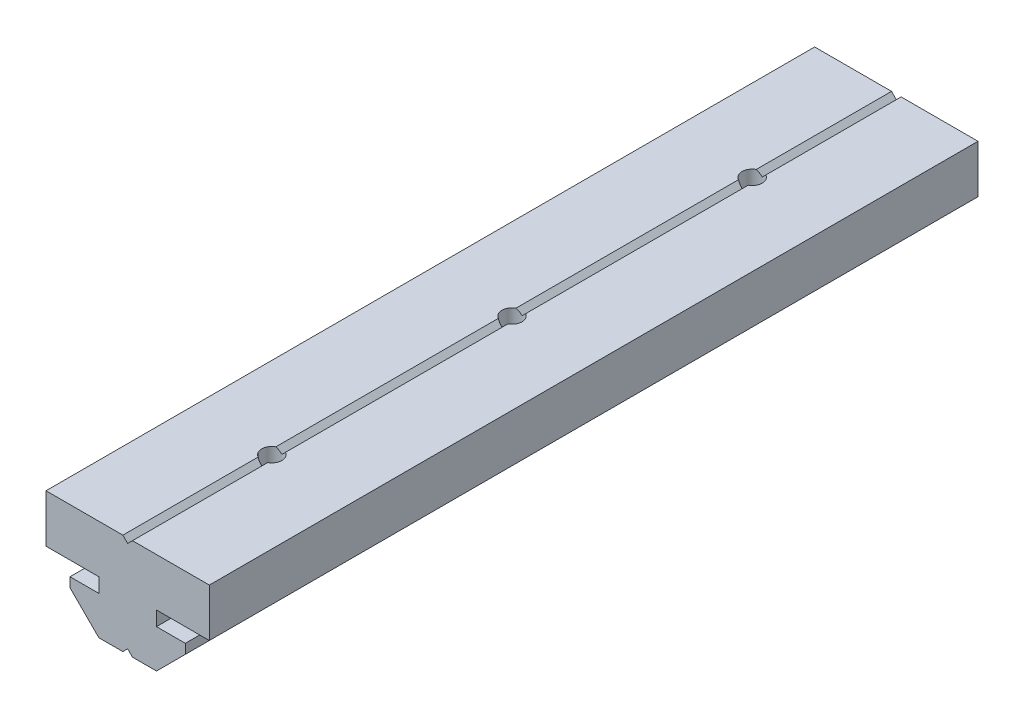
from build123d import *

# Parameters (mm, degrees)
BOSS_EXTRU_1_DEPTH      = 80
ESQUISSE2_R             = 1.05
ENL_V_MAT_EXTRU_1_DEPTH = 82.132607502


with BuildPart() as part:
    # Esquisse1 → Boss.-Extru.1 (new body)
    with BuildSketch(Plane.XY):
        Polygon((0, 10), (0.5, 10.5), (8.5, 10.5), (8.5, 5.5), (3, 5.5), (3, 4), (6, 4), (6, 3), (3, 0), (0.5, 0), (0, 0.5), (-0.5, 0), (-3, 0), (-6, 3), (-6, 4), (-3, 4), (-3, 5.5), (-8.5, 5.5), (-8.5, 10.5), (-0.5, 10.5), align=None)
    extrude(amount=BOSS_EXTRU_1_DEPTH)

    # Esquisse2 → Enlèv. mat.-Extru.1 (cut, through all)
    with BuildSketch(Plane(origin=(0, 10.5, 0), x_dir=(1, 0, 0), z_dir=(0, 1, 0))):
        with Locations(Location((0, -65, 0), (0, 0, 270))):
            Circle(ESQUISSE2_R)
        with Locations(Location((0, -40, 0), (0, 0, 270))):
            Circle(ESQUISSE2_R)
        with Locations(Location((0, -15, 0), (0, 0, 270))):
            Circle(ESQUISSE2_R)
    extrude(amount=-ENL_V_MAT_EXTRU_1_DEPTH, mode=Mode.SUBTRACT)


solid = part.part
